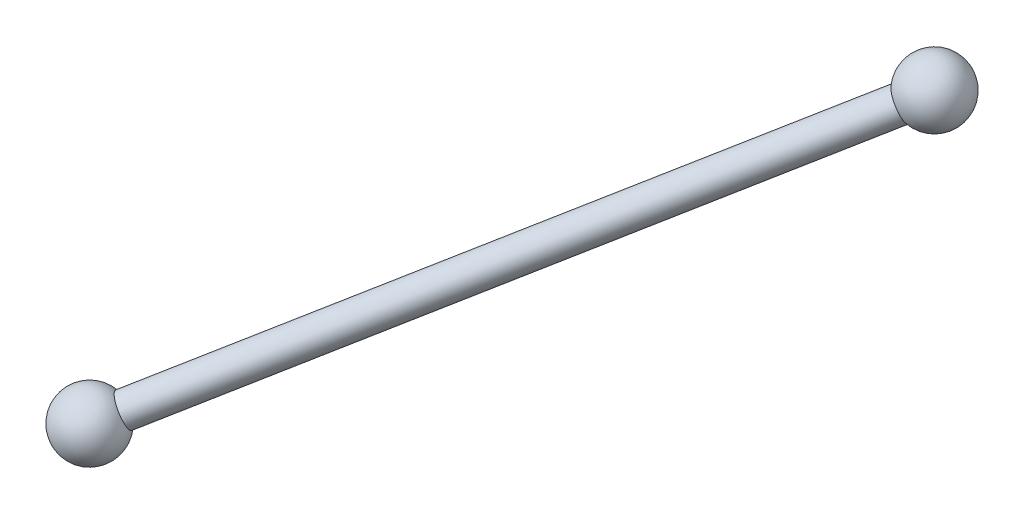
from build123d import *

# Parameters (mm, degrees)
STRAIGHT_STRUT_CORE_SKETCH_R = 1.5
STRAIGHT_STRUT_CORE_DEPTH    = 64.364941753


with BuildPart() as part:
    # Straight strut core sketch → Straight strut core (new body)
    with BuildSketch(Plane(origin=(-19.213082616, 13.127289135, 19.213082616), x_dir=(-0.7711166905176088, -0.35918583184116987, -0.5257038974648537), z_dir=(0.6366938429144502, -0.43501942576095104, -0.6366938429146632))):
        with Locations(Location((67.536559993, -74.931313845, 0), (0, 0, 23.509976133))):
            Circle(STRAIGHT_STRUT_CORE_SKETCH_R)
    extrude(amount=STRAIGHT_STRUT_CORE_DEPTH)

    # Ball end1 profile → Ball end1 (revolve)
    with BuildSketch(Plane(origin=(0, -73, 0), x_dir=(-1, 0, 0), z_dir=(0, -1, 0))):
        with BuildLine():
            Line((71.291651246, -28.980762114), (71.291651246, -22.980762114))
            ThreePointArc((71.291651246, -22.980762114), (68.291651246, -25.980762114), (71.291651246, -28.980762114))
        make_face()
    revolve(axis=Axis((-71.291651246, -73, 15.980762114), (0, 0, 1)))

    # Ball end2 profile → Ball end2 (revolve)
    with BuildSketch(Plane(origin=(0, -101, 0), x_dir=(-1, 0, 0), z_dir=(0, -1, 0))):
        with BuildLine():
            Line((30.310889133, 12), (30.310889133, 18))
            ThreePointArc((30.310889133, 18), (27.310889133, 15), (30.310889133, 12))
        make_face()
    revolve(axis=Axis((-30.310889133, -101, -25), (0, 0, 1)))


with BuildPart() as body_2:
    # Mirror1: mirrored copy
    add(part.part.mirror(Plane(origin=(0, 0, 0), x_dir=(0, 0, 1), z_dir=(0, -1, 0))))


solid = body_2.part
